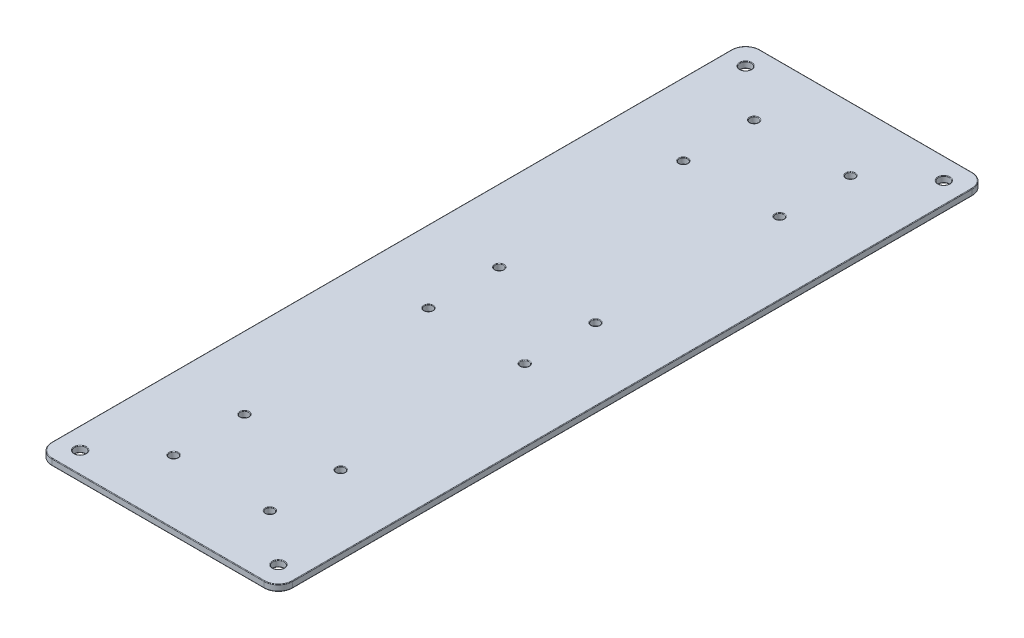
from build123d import *

# Parameters (mm, degrees)
SKETCH1_W           = 85
SKETCH1_H           = 250
BOSS_EXTRUDE1_DEPTH = 2.25
SKETCH4_R           = 2
SKETCH4_R_2         = 1.5
CUT_EXTRUDE1_DEPTH  = 2.25
FILLET1_R           = 5
FILLET3_R           = 0.2


with BuildPart() as part:
    # Sketch1 → Boss-Extrude1 (new body)
    with BuildSketch(Plane(origin=(0, 0, 0), x_dir=(1, 0, 0), z_dir=(0, 1, 0))):
        with Locations((42.5, -125)):
            Rectangle(SKETCH1_W, SKETCH1_H)
    extrude(amount=BOSS_EXTRUDE1_DEPTH)

    # Sketch4 → Cut-Extrude1 (cut)
    with BuildSketch(Plane(origin=(0, 2.25, 0), x_dir=(1, 0, 0), z_dir=(0, 1, 0))):
        with Locations(Location((7.5, -7.5, 0), (0, 0, 270))):
            Circle(SKETCH4_R)
        with Locations(Location((77.5, -7.5, 0), (0, 0, 270))):
            Circle(SKETCH4_R)
        with Locations(Location((25.5, -22.5, 0), (0, 0, 270))):
            Circle(SKETCH4_R_2)
        with Locations(Location((59.5, -22.5, 0), (0, 0, 270))):
            Circle(SKETCH4_R_2)
        with Locations(Location((25.5, -47.5, 0), (0, 0, 270))):
            Circle(SKETCH4_R_2)
        with Locations(Location((59.5, -47.5, 0), (0, 0, 270))):
            Circle(SKETCH4_R_2)
        with Locations(Location((25.5, -112.5, 0), (0, 0, 270))):
            Circle(SKETCH4_R_2)
        with Locations(Location((59.5, -112.5, 0), (0, 0, 270))):
            Circle(SKETCH4_R_2)
        with Locations(Location((25.5, -137.5, 0), (0, 0, 270))):
            Circle(SKETCH4_R_2)
        with Locations(Location((59.5, -137.5, 0), (0, 0, 270))):
            Circle(SKETCH4_R_2)
        with Locations(Location((59.5, -202.5, 0), (0, 0, 270))):
            Circle(SKETCH4_R_2)
        with Locations(Location((25.5, -202.5, 0), (0, 0, 270))):
            Circle(SKETCH4_R_2)
        with Locations(Location((59.5, -227.5, 0), (0, 0, 270))):
            Circle(SKETCH4_R_2)
        with Locations(Location((25.5, -227.5, 0), (0, 0, 270))):
            Circle(SKETCH4_R_2)
        with Locations(Location((77.5, -242.5, 0), (0, 0, 270))):
            Circle(SKETCH4_R)
        with Locations(Location((7.5, -242.5, 0), (0, 0, 270))):
            Circle(SKETCH4_R)
    extrude(amount=-CUT_EXTRUDE1_DEPTH, mode=Mode.SUBTRACT)

    # Fillet1
    fillet1_edges = [part.edges().sort_by_distance(p)[0] for p in [
        (0, 1.125, 0),
        (85, 1.125, 0),
        (85, 1.125, 250),
        (0, 1.125, 250),
    ]]
    fillet(fillet1_edges, radius=FILLET1_R)

    # Fillet3
    fillet3_edges = [part.edges().sort_by_distance(p)[0] for p in [
        (59.5, 2.25, 46),
        (59.5, 0, 46),
        (25.5, 2.25, 111),
        (25.5, 0, 111),
        (59.5, 2.25, 111),
        (59.5, 0, 111),
        (25.5, 2.25, 136),
        (25.5, 0, 136),
        (77.5, 2.25, 5.5),
        (77.5, 0, 5.5),
        (25.5, 2.25, 21),
        (25.5, 0, 21),
        (59.5, 2.25, 21),
        (59.5, 0, 21),
        (25.5, 2.25, 46),
        (25.5, 0, 46),
        (7.5, 2.25, 240.5),
        (7.5, 0, 240.5),
        (77.5, 2.25, 240.5),
        (77.5, 0, 240.5),
        (25.5, 2.25, 226),
        (25.5, 0, 226),
        (59.5, 2.25, 136),
        (59.5, 0, 136),
        (59.5, 2.25, 201),
        (59.5, 0, 201),
        (25.5, 2.25, 201),
        (25.5, 0, 201),
        (59.5, 2.25, 226),
        (59.5, 0, 226),
        (7.5, 2.25, 5.5),
        (7.5, 0, 5.5),
        (42.5, 0, 250),
        (42.5, 2.25, 250),
        (0, 0, 125),
        (42.5, 0, 0),
        (85, 0, 125),
        (83.535533906, 0, 248.535533906),
        (83.535533906, 0, 1.464466094),
        (1.464466094, 0, 1.464466094),
        (1.464466094, 0, 248.535533906),
        (0, 2.25, 125),
        (85, 2.25, 125),
        (42.5, 2.25, 0),
        (83.535533906, 2.25, 248.535533906),
        (83.535533906, 2.25, 1.464466094),
        (1.464466094, 2.25, 1.464466094),
        (1.464466094, 2.25, 248.535533906),
    ]]
    fillet(fillet3_edges, radius=FILLET3_R)


solid = part.part
